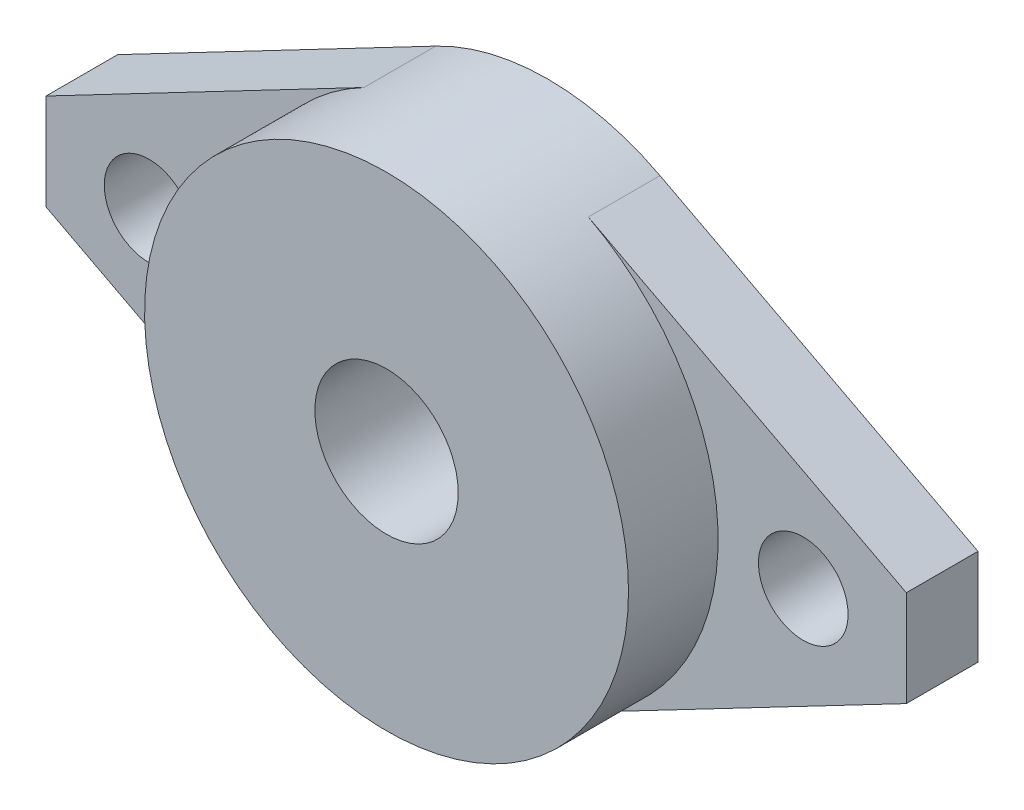
from build123d import *

# Parameters (mm, degrees)
CROQUIS1_R              = 2.5
CROQUIS1_R_2            = 4
SALIENTE_EXTRUIR1_DEPTH = 4
CROQUIS2_R              = 13.5
CROQUIS2_R_2            = 4
SALIENTE_EXTRUIR2_DEPTH = 5


with BuildPart() as part:
    # Croquis1 → Saliente-Extruir1 (new body)
    with BuildSketch(Plane.XY):
        with BuildLine():
            Line((24, 2.678571429), (24, -2.678571429))
            Line((24, -2.678571429), (6.258759048, -11.961518933))
            ThreePointArc((6.258759048, -11.961518933), (0, -13.5), (-6.258759048, -11.961518933))
            Line((-6.258759048, -11.961518933), (-24, -2.678571429))
            Line((-24, -2.678571429), (-24, 2.678571429))
            Line((-24, 2.678571429), (-6.258759048, 11.961518933))
            ThreePointArc((-6.258759048, 11.961518933), (0, 13.5), (6.258759048, 11.961518933))
            Line((6.258759048, 11.961518933), (24, 2.678571429))
        make_face()
        with Locations((18.25, 0)):
            Circle(CROQUIS1_R, mode=Mode.SUBTRACT)
        with Locations(Location((-18.25, 0, 0), (0, 0, 180))):
            Circle(CROQUIS1_R, mode=Mode.SUBTRACT)
        Circle(CROQUIS1_R_2, mode=Mode.SUBTRACT)
    extrude(amount=SALIENTE_EXTRUIR1_DEPTH)

    # Croquis2 → Saliente-Extruir2 (add)
    with BuildSketch(Plane.XY.offset(4)):
        with Locations(Location((0, 0, 0), (0, 0, 117.620415862))):
            Circle(CROQUIS2_R)
        Circle(CROQUIS2_R_2, mode=Mode.SUBTRACT)
    extrude(amount=SALIENTE_EXTRUIR2_DEPTH)


solid = part.part
